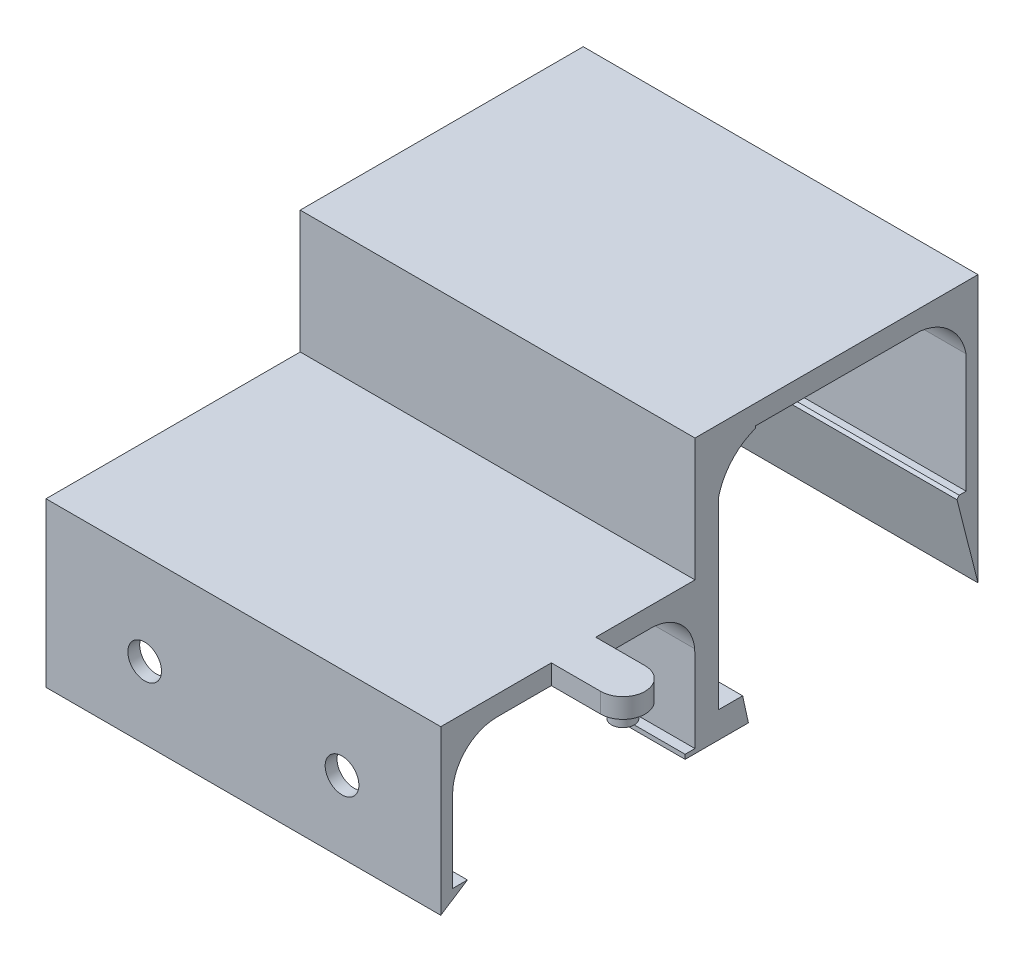
from build123d import *

# Parameters (mm, degrees)
BOSS_EXTRUDE1_DEPTH      = 20
BOSS_EXTRUDE1_DEPTH_BACK = 20
BOSS_EXTRUDE2_DEPTH      = 2
SKETCH3_R                = 1.150002101
BOSS_EXTRUDE3_DEPTH      = 1.5
SKETCH4_R                = 4.175000755
CUT_EXTRUDE2_DEPTH       = 2
SKETCH5_R                = 1.705230735
SKETCH5_R_2              = 1.707530227
CUT_EXTRUDE4_DEPTH       = 2


with BuildPart() as part:
    # Sketch1 → Boss-Extrude1 (new, two sides: drawn at the far end of the back side and taken through both)
    with BuildSketch(Plane(origin=(0, 0, 0), x_dir=(0, 0, -1), z_dir=(1, 0, 0)).offset(-BOSS_EXTRUDE1_DEPTH_BACK)):
        with BuildLine():
            Line((-187.472492456, -316.815644503), (-187.472492456, -325.115650892))
            Line((-187.472492456, -325.115650892), (-185.972481966, -325.115650892))
            Line((-185.972481966, -325.115650892), (-188.672482967, -326.869040728))
            Line((-188.672482967, -326.869040728), (-188.672482967, -312.315642834))
            Line((-188.672482967, -312.315642834), (-188.672482967, -310.315638781))
            Line((-188.672482967, -310.315638781), (-162.915930152, -310.315638781))
            Line((-162.915930152, -310.315638781), (-162.915930152, -297.865658998))
            Line((-162.915930152, -297.865658998), (-134.240537882, -297.865658998))
            Line((-134.240537882, -297.865658998), (-134.240537882, -324.915647507))
            Line((-134.240537882, -324.915647507), (-136.367589235, -316.556811333))
            Line((-136.367589235, -316.556811333), (-136.14474237, -316.270142794))
            Line((-136.14474237, -316.270142794), (-135.440543294, -316.270142794))
            Line((-135.440543294, -316.270142794), (-135.440543294, -304.221749306))
            ThreePointArc((-135.440543294, -304.221749306), (-137.058677208, -301.304506823), (-140.081375837, -299.893140793))
            Line((-140.081375837, -299.893140793), (-156.763136387, -299.865663052))
            Line((-156.763136387, -299.865663052), (-156.763136387, -300.066769123))
            ThreePointArc((-156.763136387, -300.066769123), (-159.209325453, -301.733847579), (-160.555794835, -304.370135069))
            Line((-160.555794835, -304.370135069), (-160.555794835, -322.901427746))
            Line((-160.555794835, -322.901427746), (-158.084884286, -322.901427746))
            Line((-158.084884286, -322.901427746), (-157.503083348, -325.565636158))
            Line((-157.503083348, -325.565636158), (-162.915930152, -325.565636158))
            Line((-162.915930152, -325.565636158), (-163.915917277, -325.565636158))
            Line((-163.915917277, -325.565636158), (-163.915917277, -325.115650892))
            Line((-163.915917277, -325.115650892), (-162.915930152, -325.115650892))
            Line((-162.915930152, -325.115650892), (-162.940576673, -316.345274448))
            ThreePointArc((-162.940576673, -316.345274448), (-164.404833902, -313.471500259), (-167.41591692, -312.315642834))
            Line((-167.41591692, -312.315642834), (-182.972493545, -312.315642834))
            ThreePointArc((-182.972493545, -312.315642834), (-186.154473458, -313.633663782), (-187.472492456, -316.815644503))
        make_face()
    extrude(amount=BOSS_EXTRUDE1_DEPTH + BOSS_EXTRUDE1_DEPTH_BACK)

    # Sketch2 → Boss-Extrude2 (add)
    with BuildSketch(Plane(origin=(0, -310.315638781, 0), x_dir=(1, 0, 0), z_dir=(0, 1, 0))):
        with BuildLine():
            Line((19.999999553, -172.972485423), (25.000000373, -172.972485423))
            ThreePointArc((25.000000373, -172.972485423), (27.250001207, -175.222486258), (25.000000373, -177.472487092))
            Line((25.000000373, -177.472487092), (19.999999553, -177.472487092))
            Line((19.999999553, -177.472487092), (19.999999553, -172.972485423))
        make_face()
    extrude(amount=-BOSS_EXTRUDE2_DEPTH)


with BuildPart() as boss_extrude3_tool:
    # Sketch3 → Boss-Extrude3 (new body)
    with BuildSketch(Plane.XZ.offset(312.315642834)):
        with Locations((25.000001633, 175.222481271)):
            Circle(SKETCH3_R)
    extrude(amount=BOSS_EXTRUDE3_DEPTH)


with BuildPart() as part_1:
    add(part.part)


with BuildPart() as part_2:
    # Boss-Extrude3: joined with boss_extrude3_tool
    add(part_1.part.fuse(boss_extrude3_tool.part, tol=0.00001))

    # Sketch4 → Cut-Extrude2 (cut)
    with BuildSketch(Plane(origin=(0, 0, 134.240537882), x_dir=(-1, 0, 0), z_dir=(0, 0, -1))):
        with Locations((-3.97e-07, -310.01564175)):
            Circle(SKETCH4_R)
    extrude(amount=-CUT_EXTRUDE2_DEPTH, mode=Mode.SUBTRACT)

    # Sketch5 → Cut-Extrude4 (cut)
    with BuildSketch(Plane.XY.offset(188.672482967)):
        with Locations((-10.003669951, -319.597688846)):
            Circle(SKETCH5_R)
        with Locations((9.993329109, -319.599979292)):
            Circle(SKETCH5_R_2)
    extrude(amount=-CUT_EXTRUDE4_DEPTH, mode=Mode.SUBTRACT)


solid = part_2.part
